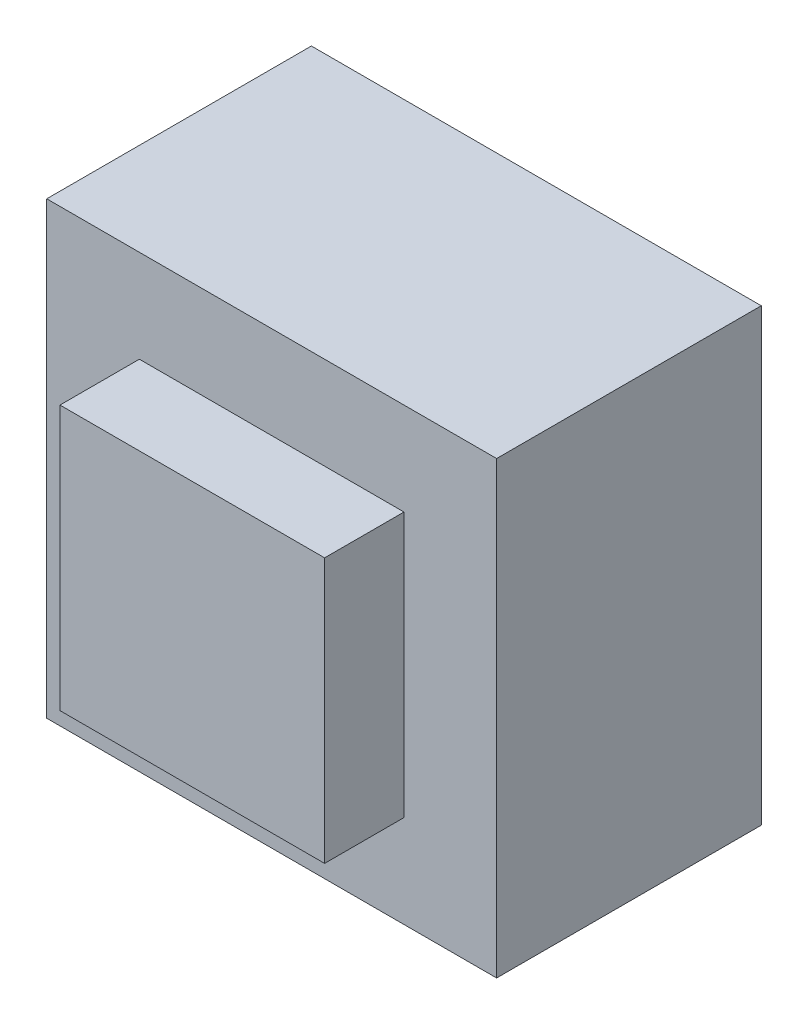
from build123d import *

# Parameters (mm, degrees)
SKETCH_5_W      = 1.7
SKETCH_5_H      = 1.7
EXTRUDE_3_DEPTH = 1
SKETCH_17_W     = 1
SKETCH_17_H     = 1
EXTRUDE_4_DEPTH = 0.3


with BuildPart() as part:
    # Эскиз5 → Бобышка-Вытянуть3 (new body)
    with BuildSketch(Plane.XY):
        with Locations((0.85, 0.85)):
            Rectangle(SKETCH_5_W, SKETCH_5_H)
    extrude(amount=EXTRUDE_3_DEPTH)

    # Эскиз17 → Бобышка-Вытянуть4 (add)
    with BuildSketch(Plane.XY.offset(1)):
        with Locations((0.85, 0.85)):
            Rectangle(SKETCH_17_W, SKETCH_17_H)
    extrude(amount=EXTRUDE_4_DEPTH)


solid = part.part
